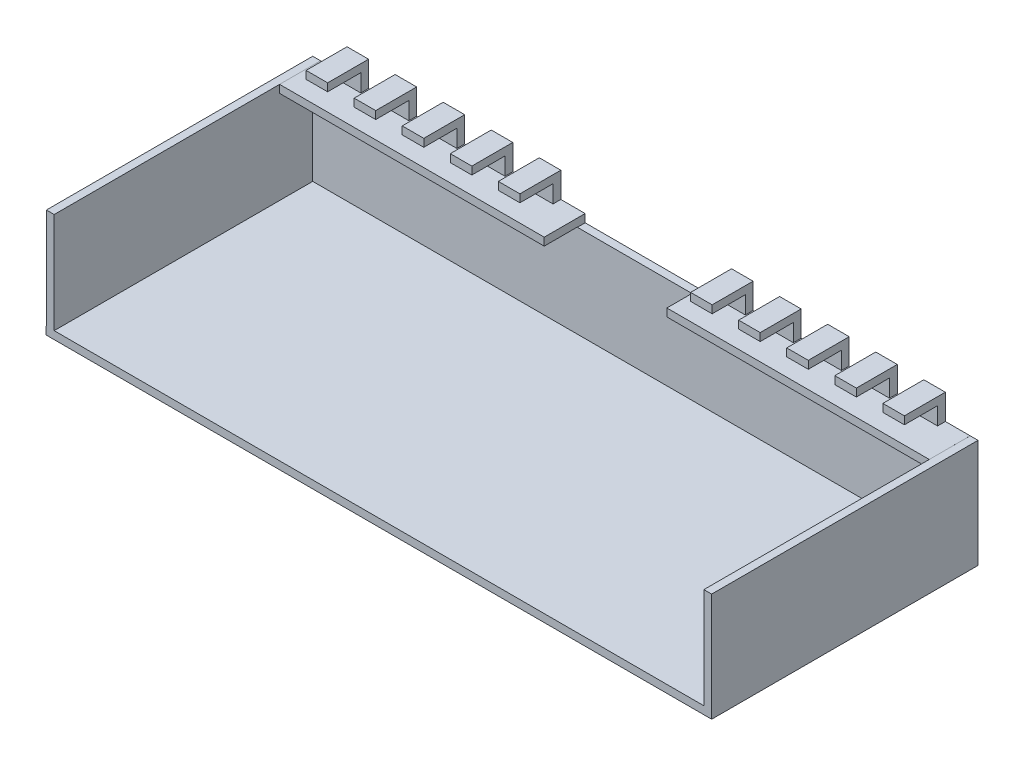
from build123d import *

# Parameters (mm, degrees)
BOSS_EXTRU_1_DEPTH      = 10
ESQUISSE1_W             = 196
ESQUISSE1_H             = 2.35
BOSS_EXTRU_1_2_DEPTH    = 10
ESQUISSE2_W             = 196
ESQUISSE2_H             = 38
BOSS_EXTRU_2_DEPTH      = 2.35
ESQUISSE3_W             = 80.35
ESQUISSE3_H             = 30.346426361
BOSS_EXTRU_4_DEPTH      = 2.35
BOSS_EXTRU_5_DEPTH      = 2.35
BOSS_EXTRU_6_DEPTH      = 68
BOSS_EXTRU_6_DEPTH_BACK = 12.35
ESQUISSE6_W             = 200.815081418
ESQUISSE6_H             = 2.35
ESQUISSE7_W             = 8
ESQUISSE7_H             = 7.65
ENL_V_MAT_EXTRU_1_DEPTH = 13
ESQUISSE9_W             = 37
ESQUISSE9_H             = 12
ENL_V_MAT_EXTRU_2_DEPTH = 13


with BuildPart() as part:
    # Esquisse1 → Boss.-Extru.1 (new body)
    with BuildSketch(Plane.XY):
        Polygon((122.5, 2.35), (122.5, 0), (0, 0), (-73.5, 0), (-73.5, 2.35), align=None)
    extrude(amount=BOSS_EXTRU_1_DEPTH)



with BuildPart() as body_2:
    # Esquisse1 → Boss.-Extru.1 2 (new body)
    with BuildSketch(Plane.XY):
        with Locations((24.5, -6.475)):
            Rectangle(ESQUISSE1_W, ESQUISSE1_H)
    extrude(amount=BOSS_EXTRU_1_2_DEPTH)


with BuildPart() as part_1:
    add(part.part)

    add(body_2.part)  # Boss.-Extru.2 merges body 2
    # Esquisse2 → Boss.-Extru.2 (add)
    with BuildSketch(Plane(origin=(0, 0, 0), x_dir=(-1, 0, 0), z_dir=(0, 0, -1))):
        with Locations((-24.5, -16.65)):
            Rectangle(ESQUISSE2_W, ESQUISSE2_H)
    extrude(amount=BOSS_EXTRU_2_DEPTH)

    # Esquisse3 → Boss.-Extru.4 (add)
    with BuildSketch(Plane.ZY.offset(73.5)):
        with Locations((37.825, -20.47678682)):
            Rectangle(ESQUISSE3_W, ESQUISSE3_H)
    extrude(amount=BOSS_EXTRU_4_DEPTH)

    # Esquisse5 → Boss.-Extru.5 (add)
    with BuildSketch(Plane(origin=(122.5, 0, 0), x_dir=(0, 0, -1), z_dir=(1, 0, 0))):
        Polygon((-78, -5.3), (2.35, -5.303573639), (2.35, -35.65), (-78, -35.65), align=None)
    extrude(amount=BOSS_EXTRU_5_DEPTH)

    # Esquisse6 → Boss.-Extru.6 (add, two sides: drawn at the far end of the back side and taken through both)
    with BuildSketch(Plane.XY.offset(10).offset(-BOSS_EXTRU_6_DEPTH_BACK)):
        with Locations((24.442459291, -36.825)):
            Rectangle(ESQUISSE6_W, ESQUISSE6_H)
    extrude(amount=BOSS_EXTRU_6_DEPTH + BOSS_EXTRU_6_DEPTH_BACK)

    # Esquisse7 → Enlèv. mat.-Extru.1 (cut)
    with BuildSketch(Plane.XY.offset(10)):
        with Locations((-69.5, -1.475)):
            Rectangle(ESQUISSE7_W, ESQUISSE7_H)
        with Locations((-55, -1.475)):
            Rectangle(ESQUISSE7_W, ESQUISSE7_H)
        with Locations((-40.5, -1.475)):
            Rectangle(ESQUISSE7_W, ESQUISSE7_H)
        with Locations((-26, -1.475)):
            Rectangle(ESQUISSE7_W, ESQUISSE7_H)
        with Locations((-11.5, -1.475)):
            Rectangle(ESQUISSE7_W, ESQUISSE7_H)
        with Locations((3, -1.475)):
            Rectangle(ESQUISSE7_W, ESQUISSE7_H)
        with Locations((17.5, -1.475)):
            Rectangle(ESQUISSE7_W, ESQUISSE7_H)
        with Locations((32, -1.475)):
            Rectangle(ESQUISSE7_W, ESQUISSE7_H)
        with Locations((46.5, -1.475)):
            Rectangle(ESQUISSE7_W, ESQUISSE7_H)
        with Locations((61, -1.475)):
            Rectangle(ESQUISSE7_W, ESQUISSE7_H)
        with Locations((75.5, -1.475)):
            Rectangle(ESQUISSE7_W, ESQUISSE7_H)
        with Locations((90, -1.475)):
            Rectangle(ESQUISSE7_W, ESQUISSE7_H)
        with Locations((104.5, -1.475)):
            Rectangle(ESQUISSE7_W, ESQUISSE7_H)
        with Locations((119, -1.475)):
            Rectangle(ESQUISSE7_W, ESQUISSE7_H)
        with Locations((133.5, -1.475)):
            Rectangle(ESQUISSE7_W, ESQUISSE7_H)
        with Locations((148, -1.475)):
            Rectangle(ESQUISSE7_W, ESQUISSE7_H)
        with Locations((162.5, -1.475)):
            Rectangle(ESQUISSE7_W, ESQUISSE7_H)
        with Locations((177, -1.475)):
            Rectangle(ESQUISSE7_W, ESQUISSE7_H)
        with Locations((191.5, -1.475)):
            Rectangle(ESQUISSE7_W, ESQUISSE7_H)
        with Locations((206, -1.475)):
            Rectangle(ESQUISSE7_W, ESQUISSE7_H)
        with Locations((220.5, -1.475)):
            Rectangle(ESQUISSE7_W, ESQUISSE7_H)
        with Locations((235, -1.475)):
            Rectangle(ESQUISSE7_W, ESQUISSE7_H)
        with Locations((249.5, -1.475)):
            Rectangle(ESQUISSE7_W, ESQUISSE7_H)
        with Locations((264, -1.475)):
            Rectangle(ESQUISSE7_W, ESQUISSE7_H)
        with Locations((278.5, -1.475)):
            Rectangle(ESQUISSE7_W, ESQUISSE7_H)
        with Locations((293, -1.475)):
            Rectangle(ESQUISSE7_W, ESQUISSE7_H)
        with Locations((307.5, -1.475)):
            Rectangle(ESQUISSE7_W, ESQUISSE7_H)
        with Locations((322, -1.475)):
            Rectangle(ESQUISSE7_W, ESQUISSE7_H)
        with Locations((336.5, -1.475)):
            Rectangle(ESQUISSE7_W, ESQUISSE7_H)
        with Locations((351, -1.475)):
            Rectangle(ESQUISSE7_W, ESQUISSE7_H)
        with Locations((365.5, -1.475)):
            Rectangle(ESQUISSE7_W, ESQUISSE7_H)
        with Locations((380, -1.475)):
            Rectangle(ESQUISSE7_W, ESQUISSE7_H)
        with Locations((394.5, -1.475)):
            Rectangle(ESQUISSE7_W, ESQUISSE7_H)
        with Locations((409, -1.475)):
            Rectangle(ESQUISSE7_W, ESQUISSE7_H)
        with Locations((423.5, -1.475)):
            Rectangle(ESQUISSE7_W, ESQUISSE7_H)
        with Locations((438, -1.475)):
            Rectangle(ESQUISSE7_W, ESQUISSE7_H)
        with Locations((452.5, -1.475)):
            Rectangle(ESQUISSE7_W, ESQUISSE7_H)
        with Locations((467, -1.475)):
            Rectangle(ESQUISSE7_W, ESQUISSE7_H)
        with Locations((481.5, -1.475)):
            Rectangle(ESQUISSE7_W, ESQUISSE7_H)
        with Locations((496, -1.475)):
            Rectangle(ESQUISSE7_W, ESQUISSE7_H)
        with Locations((510.5, -1.475)):
            Rectangle(ESQUISSE7_W, ESQUISSE7_H)
        with Locations((525, -1.475)):
            Rectangle(ESQUISSE7_W, ESQUISSE7_H)
        with Locations((539.5, -1.475)):
            Rectangle(ESQUISSE7_W, ESQUISSE7_H)
        with Locations((554, -1.475)):
            Rectangle(ESQUISSE7_W, ESQUISSE7_H)
        with Locations((568.5, -1.475)):
            Rectangle(ESQUISSE7_W, ESQUISSE7_H)
        with Locations((583, -1.475)):
            Rectangle(ESQUISSE7_W, ESQUISSE7_H)
        with Locations((597.5, -1.475)):
            Rectangle(ESQUISSE7_W, ESQUISSE7_H)
        with Locations((612, -1.475)):
            Rectangle(ESQUISSE7_W, ESQUISSE7_H)
        with Locations((626.5, -1.475)):
            Rectangle(ESQUISSE7_W, ESQUISSE7_H)
        with Locations((641, -1.475)):
            Rectangle(ESQUISSE7_W, ESQUISSE7_H)
    extrude(amount=-ENL_V_MAT_EXTRU_1_DEPTH, mode=Mode.SUBTRACT)

    # Esquisse9 → Enlèv. mat.-Extru.2 (cut)
    with BuildSketch(Plane.XY.offset(10)):
        with Locations((24.838183524, -1.725435405)):
            Rectangle(ESQUISSE9_W, ESQUISSE9_H)
    extrude(amount=-ENL_V_MAT_EXTRU_2_DEPTH, mode=Mode.SUBTRACT)


solid = part_1.part
